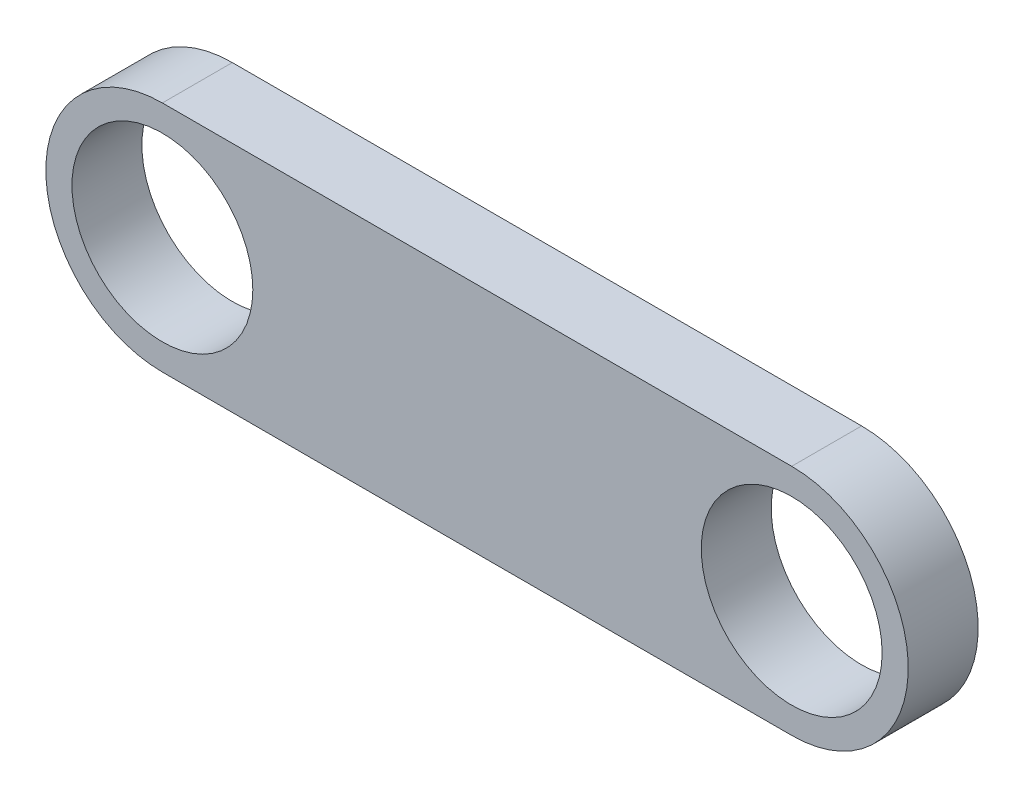
from build123d import *

# Parameters (mm, degrees)
SKETCH1_R           = 3.88
BOSS_EXTRUDE1_DEPTH = 3


with BuildPart() as part:
    # Sketch1 → Boss-Extrude1 (new body)
    with BuildSketch(Plane.XY):
        with BuildLine():
            Line((-12.201965406, -4.894629499), (14.798034594, -4.894629499))
            ThreePointArc((14.798034594, -4.894629499), (19.798034594, 0.105370501), (14.798034594, 5.105370501))
            Line((14.798034594, 5.105370501), (-12.201965406, 5.105370501))
            ThreePointArc((-12.201965406, 5.105370501), (-17.201965406, 0.105370501), (-12.201965406, -4.894629499))
        make_face()
        with Locations((-12.201965406, 0.105370501)):
            Circle(SKETCH1_R, mode=Mode.SUBTRACT)
        with Locations((14.798034594, 0.105370501)):
            Circle(SKETCH1_R, mode=Mode.SUBTRACT)
    extrude(amount=BOSS_EXTRUDE1_DEPTH)


solid = part.part
